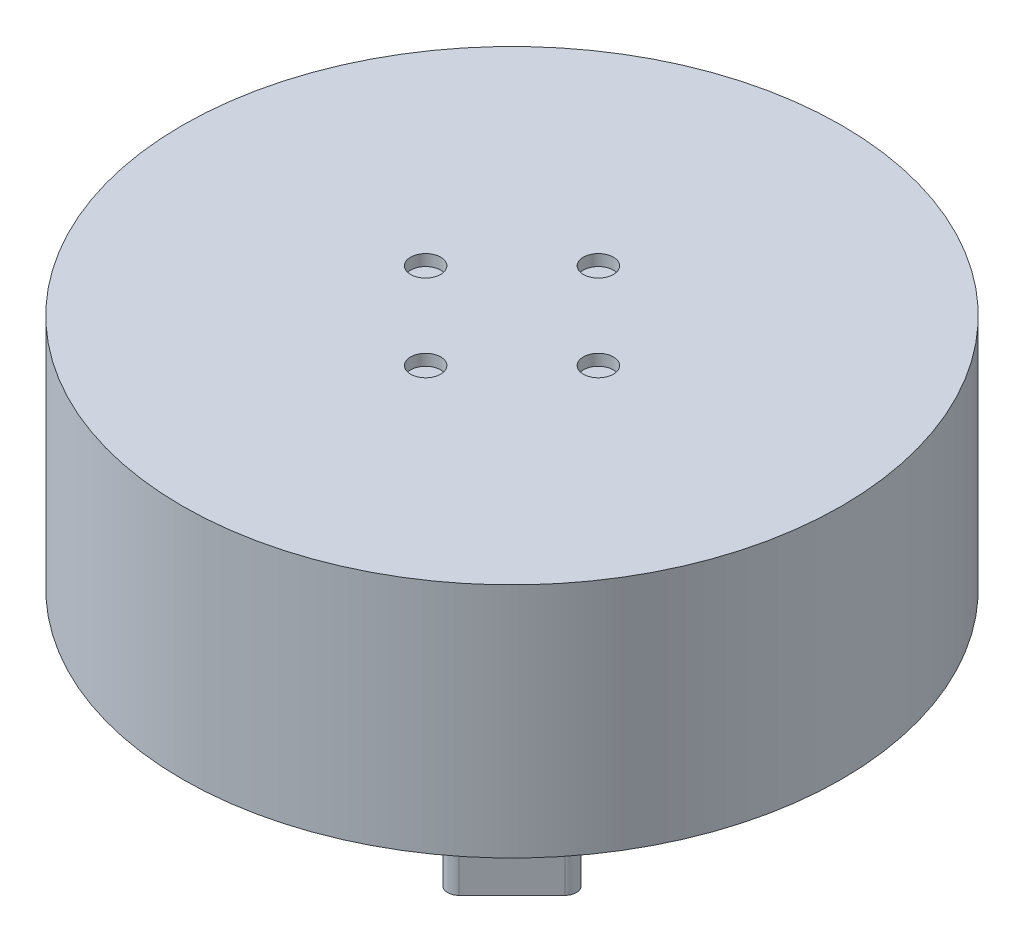
from build123d import *

# Parameters (mm, degrees)
SKETCH1_R           = 43.9
BOSS_EXTRUDE1_DEPTH = 31.5
SKETCH2_R           = 2
CUT_EXTRUDE1_DEPTH  = 1.5
BOSS_EXTRUDE2_DEPTH = 6
SKETCH4_R           = 2
CUT_EXTRUDE2_DEPTH  = 1.5


with BuildPart() as part:
    # Sketch1 → Boss-Extrude1 (new body)
    with BuildSketch(Plane(origin=(0, 0, 0), x_dir=(1, 0, 0), z_dir=(0, 1, 0))):
        with Locations(Location((0, 0, 0), (0, 0, 270))):
            Circle(SKETCH1_R)
    extrude(amount=BOSS_EXTRUDE1_DEPTH)

    # Sketch2 → Cut-Extrude1 (cut)
    with BuildSketch(Plane.XZ):
        with Locations(Location((0, 18, 0), (0, 0, 270))):
            Circle(SKETCH2_R)
        with Locations(Location((18, 0, 0), (0, 0, 270))):
            Circle(SKETCH2_R)
        with Locations(Location((0, -18, 0), (0, 0, 270))):
            Circle(SKETCH2_R)
        with Locations(Location((-18, 0, 0), (0, 0, 270))):
            Circle(SKETCH2_R)
    extrude(amount=-CUT_EXTRUDE1_DEPTH, mode=Mode.SUBTRACT)

    # Sketch3 → Boss-Extrude2 (add)
    with BuildSketch(Plane.XZ):
        with BuildLine():
            Line((25.809397513, 32.880465325), (32.880465325, 25.809397513))
            ThreePointArc((32.880465325, 25.809397513), (32.880465325, 23.68807717), (30.759144982, 23.68807717))
            Line((30.759144982, 23.68807717), (23.68807717, 30.759144982))
            ThreePointArc((23.68807717, 30.759144982), (23.68807717, 32.880465325), (25.809397513, 32.880465325))
        make_face()
    extrude(amount=BOSS_EXTRUDE2_DEPTH)

    # Sketch4 → Cut-Extrude2 (cut)
    with BuildSketch(Plane(origin=(0, 31.5, 0), x_dir=(1, 0, 0), z_dir=(0, 1, 0))):
        with Locations(Location((0, 11.5, 0), (0, 0, 270))):
            Circle(SKETCH4_R)
        with Locations(Location((11.5, 0, 0), (0, 0, 270))):
            Circle(SKETCH4_R)
        with Locations(Location((0, -11.5, 0), (0, 0, 270))):
            Circle(SKETCH4_R)
        with Locations(Location((-11.5, 0, 0), (0, 0, 270))):
            Circle(SKETCH4_R)
    extrude(amount=-CUT_EXTRUDE2_DEPTH, mode=Mode.SUBTRACT)


solid = part.part
